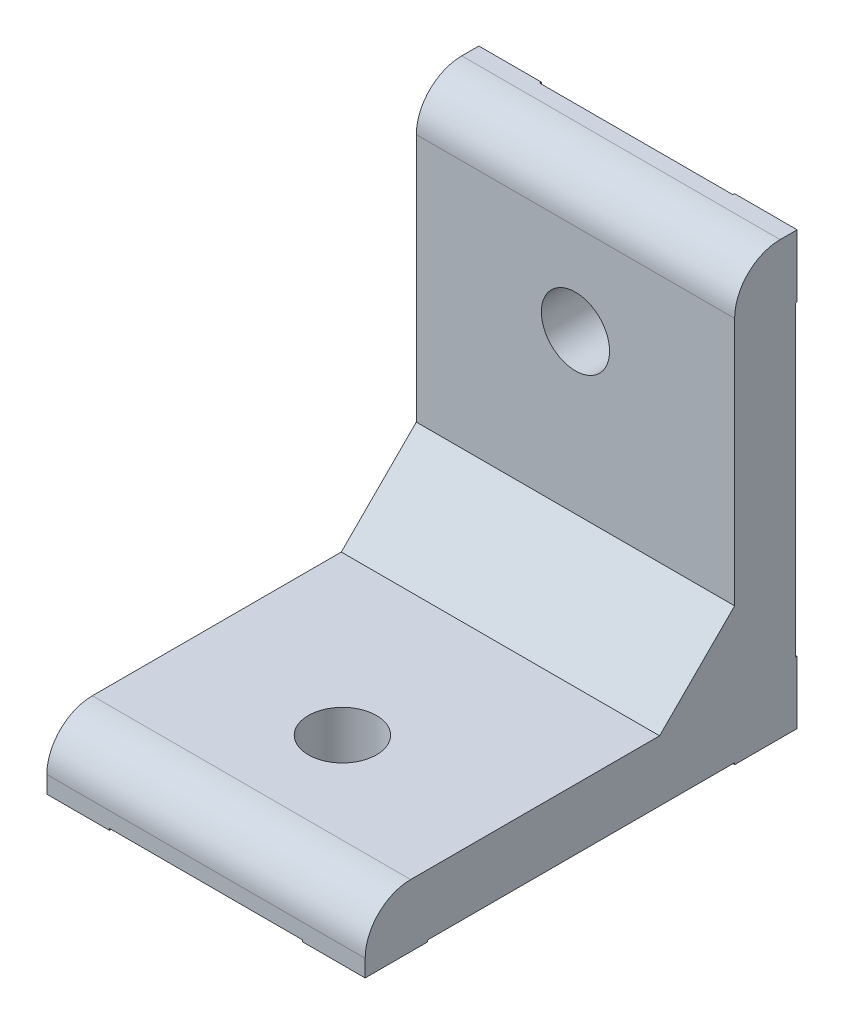
from build123d import *

# Parameters (mm, degrees)
ESBO_O1_W                = 28
ESBO_O1_H                = 38
RESSALTO_EXTRUS_O1_DEPTH = 5.5
ESBO_O2_W                = 28
ESBO_O2_H                = 5.5
RESSALTO_EXTRUS_O2_DEPTH = 32.5
CORTE_EXTRUS_O1_DEPTH    = 28
RESSALTO_EXTRUS_O3_DEPTH = 28
CORTE_EXTRUS_O2_DEPTH    = 0.15
CORTE_EXTRUS_O3_DEPTH    = 0.15
ESBO_O8_R                = 3
CORTE_EXTRUS_O4_DEPTH    = 6
ESBO_O9_R                = 3
CORTE_EXTRUS_O5_DEPTH    = 6


with BuildPart() as part:
    # Esboço1 → Ressalto-extrusão1 (new body)
    with BuildSketch(Plane.XY):
        with Locations((-17.133729377, 2.988196373)):
            Rectangle(ESBO_O1_W, ESBO_O1_H)
    extrude(amount=RESSALTO_EXTRUS_O1_DEPTH)

    # Esboço2 → Ressalto-extrusão2 (add)
    with BuildSketch(Plane.XY.offset(5.5)):
        with Locations((-17.133729377, -13.261803627)):
            Rectangle(ESBO_O2_W, ESBO_O2_H)
    extrude(amount=RESSALTO_EXTRUS_O2_DEPTH)

    # Esboço3 → Corte-extrusão1 (cut)
    with BuildSketch(Plane.ZY.offset(31.133729377)):
        with BuildLine():
            Line((1.5, 21.988196373), (5.5, 21.988196373))
            Line((5.5, 21.988196373), (5.5, 17.988196373))
            ThreePointArc((5.5, 17.988196373), (4.328427125, 20.816623498), (1.5, 21.988196373))
        make_face()
        with BuildLine():
            Line((34, -10.511803627), (38, -10.511803627))
            Line((38, -10.511803627), (38, -14.511803627))
            ThreePointArc((38, -14.511803627), (36.828427125, -11.683376502), (34, -10.511803627))
        make_face()
    extrude(amount=-CORTE_EXTRUS_O1_DEPTH, mode=Mode.SUBTRACT)

    # Esboço4 → Ressalto-extrusão3 (add)
    with BuildSketch(Plane.ZY.offset(31.133729377)):
        Polygon((5.5, -10.511803627), (12.1, -10.511803627), (5.5, -3.911803627), align=None)
    extrude(amount=-RESSALTO_EXTRUS_O3_DEPTH)

    # Esboço5 → Corte-extrusão2 (cut)
    with BuildSketch(Plane.XZ.offset(16.011803627)):
        Polygon((-25.633729377, 5.5), (-25.633729377, 0), (-8.633729377, 0), (-8.633729377, 5.5), (-3.133729377, 5.5), (-3.133729377, 32.5), (-8.633729377, 32.5), (-8.633729377, 38), (-25.633729377, 38), (-25.633729377, 32.5), (-31.133729377, 32.5), (-31.133729377, 5.5), align=None)
    extrude(amount=-CORTE_EXTRUS_O2_DEPTH, mode=Mode.SUBTRACT)

    # Esboço6 → Corte-extrusão3 (cut)
    with BuildSketch(Plane(origin=(0, 0, 0), x_dir=(-1, 0, 0), z_dir=(0, 0, -1))):
        Polygon((8.633729377, -10.511803627), (8.633729377, -15.861803627), (25.633729377, -15.861803627), (25.633729377, -10.511803627), (31.133729377, -10.511803627), (31.133729377, 16.488196373), (25.633729377, 16.488196373), (25.633729377, 21.988196373), (8.633729377, 21.988196373), (8.633729377, 16.488196373), (3.133729377, 16.488196373), (3.133729377, -10.511803627), align=None)
    extrude(amount=-CORTE_EXTRUS_O3_DEPTH, mode=Mode.SUBTRACT)

    # Esboço8 → Corte-extrusão4 (cut)
    with BuildSketch(Plane.XZ.offset(15.861803627)):
        with Locations(Location((-17.133729377, 26, 0), (0, 0, 270))):
            Circle(ESBO_O8_R)
    extrude(amount=-CORTE_EXTRUS_O4_DEPTH, mode=Mode.SUBTRACT)

    # Esboço9 → Corte-extrusão5 (cut)
    with BuildSketch(Plane(origin=(0, 0, 0.15), x_dir=(-1, 0, 0), z_dir=(0, 0, -1))):
        with Locations((17.133729377, 9.988196373)):
            Circle(ESBO_O9_R)
    extrude(amount=-CORTE_EXTRUS_O5_DEPTH, mode=Mode.SUBTRACT)


solid = part.part
